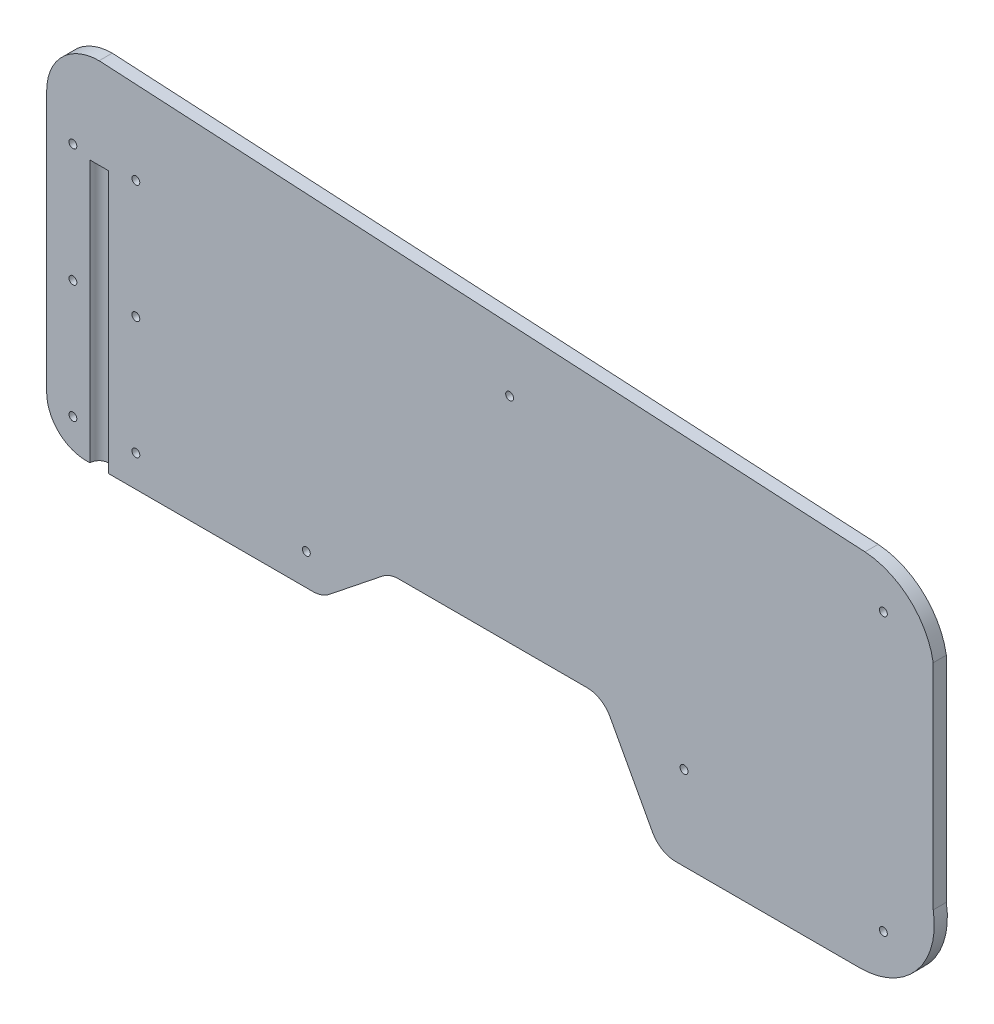
from build123d import *

# Parameters (mm, degrees)
DODANIE_WYCI_GNI_CIE1_DEPTH = 5
SZKIC1_R                    = 3.5
WYTNIJ_WYCI_GNI_CIE1_DEPTH  = 100
SZKIC3_R                    = 1.5
WYTNIJ_WYCI_GNI_CIE3_DEPTH  = 5
SZKIC5_R                    = 3
WYTNIJ_WYCI_GNI_CIE4_DEPTH  = 2.4


with BuildPart() as part:
    # outer-wire → Dodanie-wyciągnięcie1 (new body)
    with BuildSketch(Plane.XY):
        with BuildLine():
            Line((-24, -24.53020641), (62.5, -24.53020641))
            ThreePointArc((62.5, -24.53020641), (65.803504247, -23.968789974), (68.736080178, -22.347578348))
            Line((68.736080178, -22.347578348), (89, -6.182628062))
            ThreePointArc((89, -6.182628062), (91.932575931, -4.561416436), (95.236080178, -4))
            Line((95.236080178, -4), (167, -4))
            ThreePointArc((167, -4), (172.310885546, -5.526836794), (176, -9.641101056))
            Line((176, -9.641101056), (192, -39.280484771))
            ThreePointArc((192, -39.280484771), (195.676368139, -43.118069462), (200.799707694, -44.53020641))
            Line((200.799707694, -44.53020641), (271, -44.53020641))
            ThreePointArc((271, -44.53020641), (292.697243682, -34.454979346), (299, -11.3778078))
            Line((299, -11.3778078), (299, 70.236479581))
            ThreePointArc((299, 70.236479581), (290.082226047, 86.530998263), (273, 93.827270232))
            Line((273, 93.827270232), (-19, 110))
            ThreePointArc((-19, 110), (-33.142135624, 104.142135624), (-39, 90))
            Line((-39, 90), (-39, -9.53020641))
            ThreePointArc((-39, -9.53020641), (-34.606601718, -20.136808128), (-24, -24.53020641))
        make_face()
    extrude(amount=DODANIE_WYCI_GNI_CIE1_DEPTH)

    # Szkic1 → Wytnij-wyciągnięcie1 (cut)
    with BuildSketch(Plane(origin=(0, -24.53020641, 0), x_dir=(-1, 0, 0), z_dir=(0, -1, 0))):
        with Locations((19, 0)):
            Circle(SZKIC1_R)
    extrude(amount=-WYTNIJ_WYCI_GNI_CIE1_DEPTH, mode=Mode.SUBTRACT)

    # Szkic3 → Wytnij-wyciągnięcie3 (cut)
    with BuildSketch(Plane.XY.offset(5)):
        with Locations((280, -28)):
            Circle(SZKIC3_R)
        with Locations((280, 77.5)):
            Circle(SZKIC3_R)
        with Locations((-5, 77.5)):
            Circle(SZKIC3_R)
        with Locations((-29, 77.5)):
            Circle(SZKIC3_R)
        with Locations((-29, -12.5)):
            Circle(SZKIC3_R)
        with Locations((-29, 32.5)):
            Circle(SZKIC3_R)
        with Locations((-5, 32.5)):
            Circle(SZKIC3_R)
        with Locations((-5, -12.5)):
            Circle(SZKIC3_R)
        with Locations((60, -12.5)):
            Circle(SZKIC3_R)
        with Locations((204, -12.5)):
            Circle(SZKIC3_R)
        with Locations((137.5, 77.5)):
            Circle(SZKIC3_R)
    extrude(amount=-WYTNIJ_WYCI_GNI_CIE3_DEPTH, mode=Mode.SUBTRACT)

    # Szkic5 → Wytnij-wyciągnięcie4 (cut)
    with BuildSketch(Plane.XY.offset(5)):
        with Locations((-29, -12.5)):
            Circle(SZKIC5_R)
        with Locations((-29, 32.5)):
            Circle(SZKIC5_R)
        with Locations((-29, 77.5)):
            Circle(SZKIC5_R)
        with Locations((-5, 77.5)):
            Circle(SZKIC5_R)
        with Locations((-5, 32.5)):
            Circle(SZKIC5_R)
        with Locations((-5, -12.5)):
            Circle(SZKIC5_R)
        with Locations((60, -12.5)):
            Circle(SZKIC5_R)
        with Locations((137.5, 77.5)):
            Circle(SZKIC5_R)
        with Locations((204, -12.5)):
            Circle(SZKIC5_R)
        with Locations((280, -28)):
            Circle(SZKIC5_R)
        with Locations((280, 77.5)):
            Circle(SZKIC5_R)
    extrude(amount=-WYTNIJ_WYCI_GNI_CIE4_DEPTH, mode=Mode.SUBTRACT)


with BuildPart() as body_2:
    # Lustro4: mirrored copy
    add(part.part.mirror(Plane.XY.offset(5)))


solid = body_2.part
